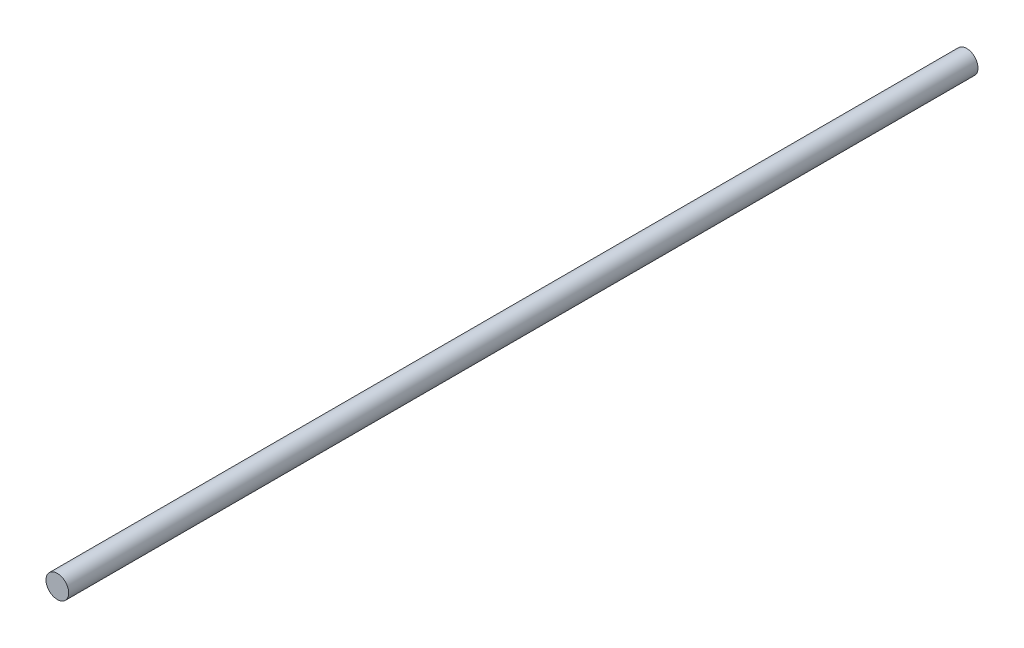
from build123d import *

# Parameters (mm, degrees)
IZIM1_R                     = 6
Y_KSEKLIK_EKSTR_ZYON1_DEPTH = 480


with BuildPart() as part:
    # Çizim1 → Yükseklik-Ekstrüzyon1 (new body)
    with BuildSketch(Plane.XY):
        Circle(IZIM1_R)
    extrude(amount=Y_KSEKLIK_EKSTR_ZYON1_DEPTH)


solid = part.part
